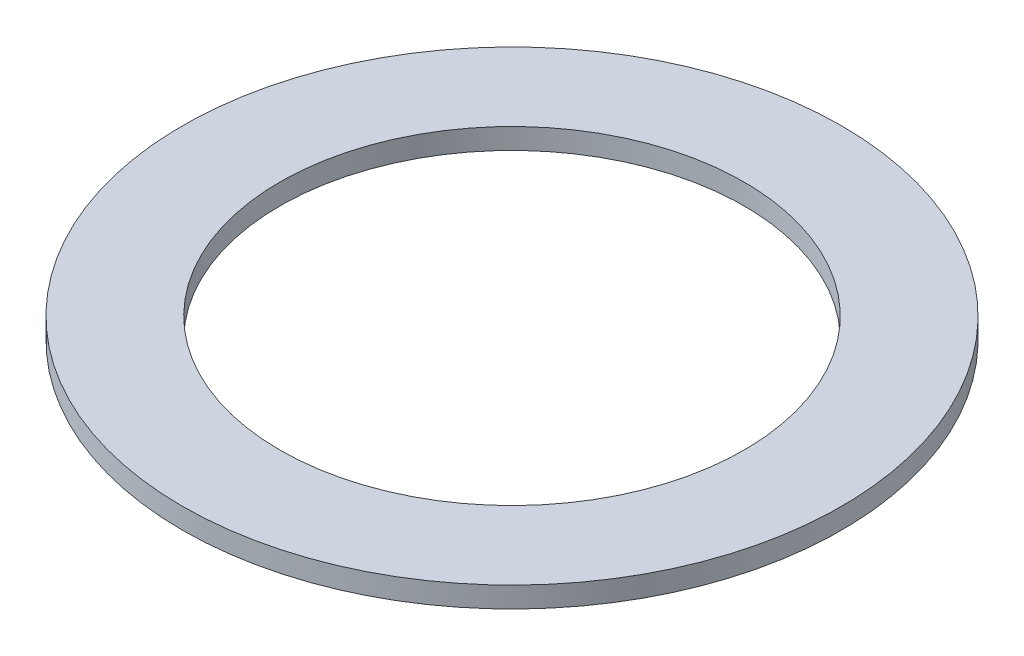
from build123d import *

# Parameters (mm, degrees)
SKETCH1_R           = 7.95
SKETCH1_R_2         = 5.6
BOSS_EXTRUDE1_DEPTH = 0.5


with BuildPart() as part:
    # Sketch1 → Boss-Extrude1 (new body)
    with BuildSketch(Plane(origin=(0, 0, 0), x_dir=(1, 0, 0), z_dir=(0, 1, 0))):
        with Locations(Location((0, 0, 0), (0, 0, 270))):
            Circle(SKETCH1_R)
        with Locations(Location((0, 0, 0), (0, 0, 270))):
            Circle(SKETCH1_R_2, mode=Mode.SUBTRACT)
    extrude(amount=BOSS_EXTRUDE1_DEPTH)


solid = part.part
